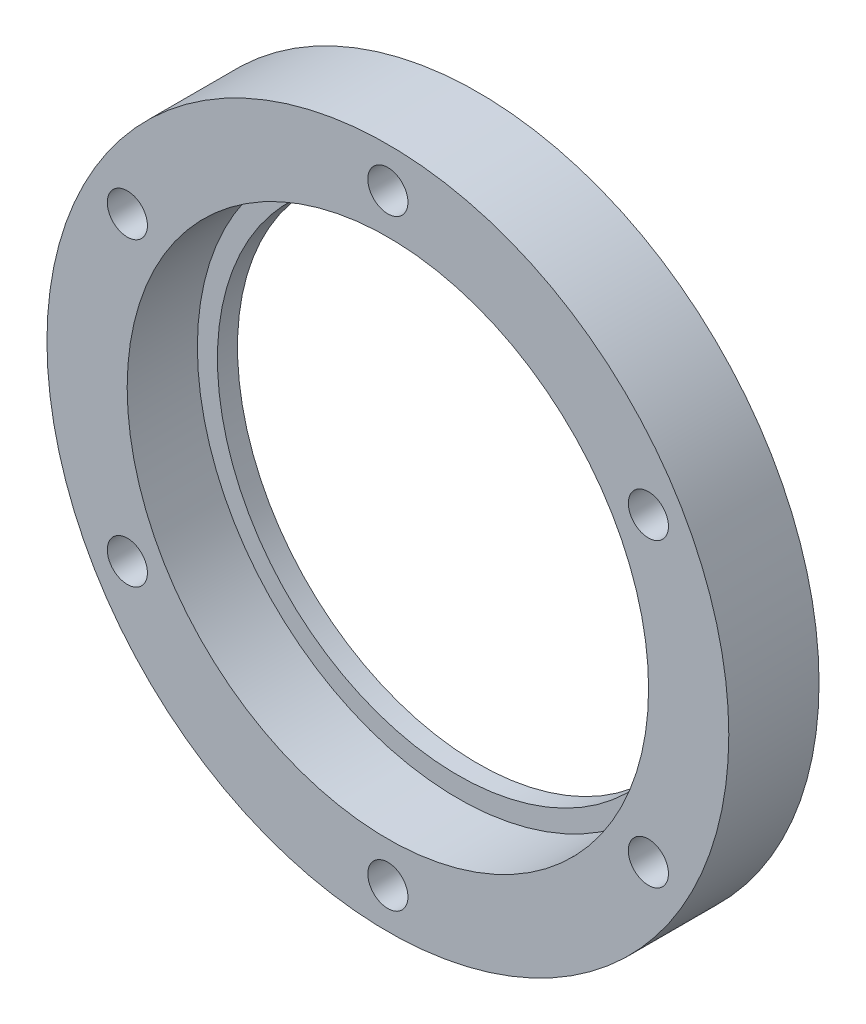
from build123d import *

# Parameters (mm, degrees)
SKETCH_1_R          = 34
EXTRUDE_1_DEPTH     = 9
SKETCH_2_R          = 26
CUT_EXTRUDE_1_DEPTH = 7
SKETCH_3_R          = 24
CUT_EXTRUDE_2_DEPTH = 8
SKETCH_4_R          = 2
CUT_EXTRUDE_3_DEPTH = 49.918299235


with BuildPart() as part:
    # 草图1 → 凸台-拉伸1 (new body)
    with BuildSketch(Plane.XY):
        Circle(SKETCH_1_R)
    extrude(amount=EXTRUDE_1_DEPTH)

    # 草图2 → 切除-拉伸1 (cut)
    with BuildSketch(Plane.XY.offset(9)):
        Circle(SKETCH_2_R)
    extrude(amount=-CUT_EXTRUDE_1_DEPTH, mode=Mode.SUBTRACT)

    # 草图3 → 切除-拉伸2 (cut)
    with BuildSketch(Plane.XY.offset(2)):
        Circle(SKETCH_3_R)
    extrude(amount=-CUT_EXTRUDE_2_DEPTH, mode=Mode.SUBTRACT)

    # 草图4 → 切除-拉伸3 (cut, through all)
    with BuildSketch(Plane.XY.offset(9)):
        with Locations((0, 30)):
            Circle(SKETCH_4_R)
        with Locations((25.980762114, 15)):
            Circle(SKETCH_4_R)
        with Locations((25.980762114, -15)):
            Circle(SKETCH_4_R)
        with Locations((0, -30)):
            Circle(SKETCH_4_R)
        with Locations((-25.980762114, -15)):
            Circle(SKETCH_4_R)
        with Locations((-25.980762114, 15)):
            Circle(SKETCH_4_R)
    extrude(amount=-CUT_EXTRUDE_3_DEPTH, mode=Mode.SUBTRACT)


solid = part.part
